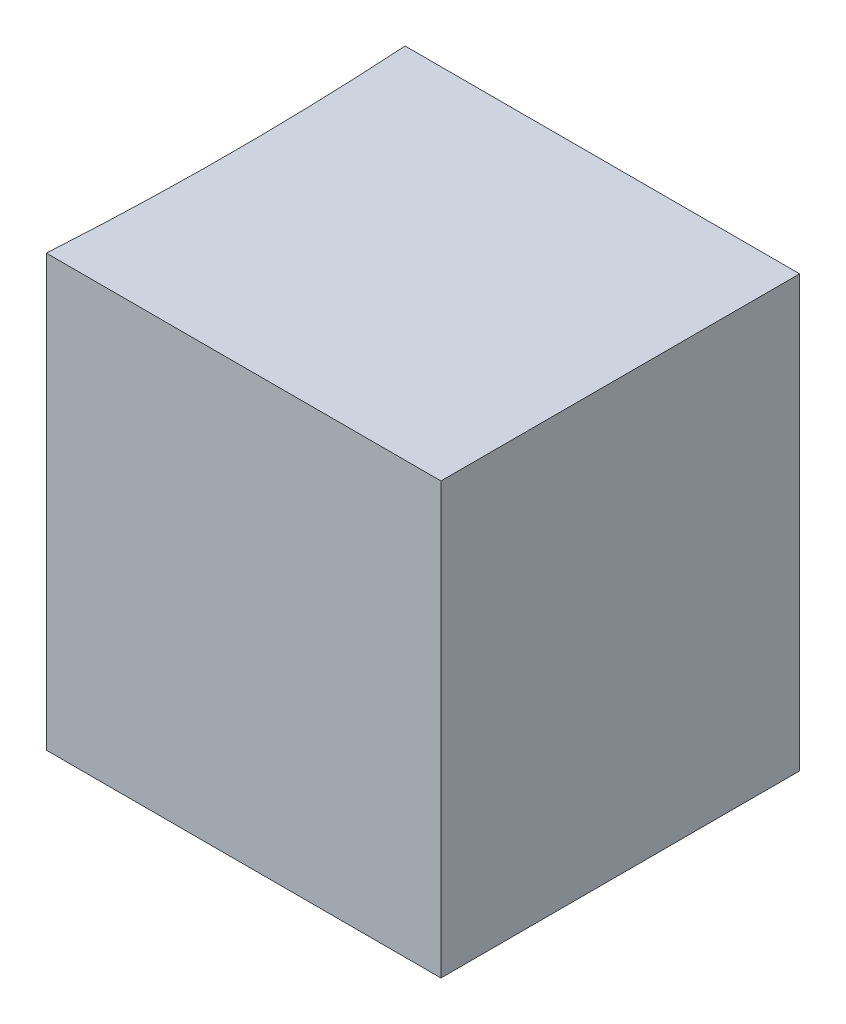
from build123d import *

# Parameters (mm, degrees)
BOSS_EXTRUDE1_DEPTH = 15.24


with BuildPart() as part:
    # Sketch1 → Boss-Extrude1 (new body)
    with BuildSketch(Plane(origin=(0, 0, 0), x_dir=(1, 0, 0), z_dir=(0, 1, 0))):
        with BuildLine():
            Line((115.371368334, -3.175), (115.371368334, 6.35))
            Line((115.371368334, 6.35), (101.401368334, 6.35))
            ThreePointArc((101.401368334, 6.35), (101.6, 0), (101.401368334, -6.35))
            Line((101.401368334, -6.35), (115.371368334, -6.35))
            Line((115.371368334, -6.35), (115.371368334, -3.175))
        make_face()
    extrude(amount=BOSS_EXTRUDE1_DEPTH)


solid = part.part
